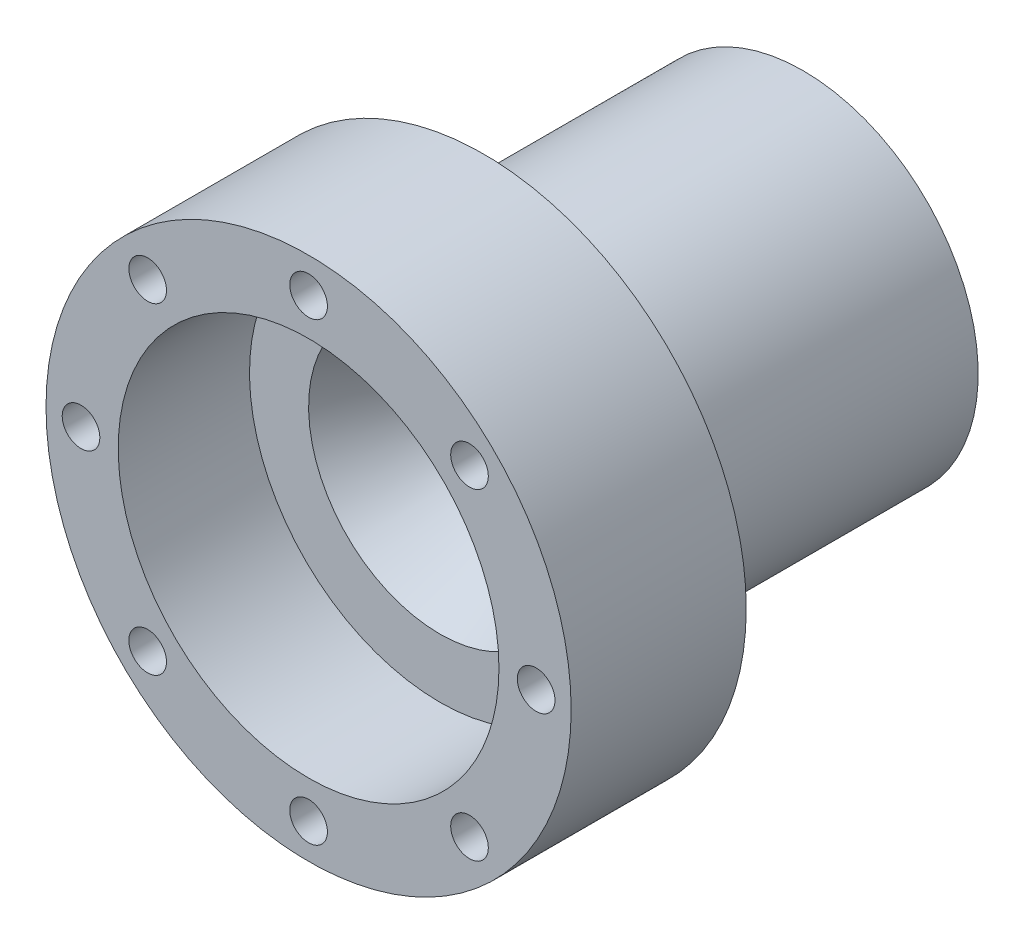
from build123d import *

# Parameters (mm, degrees)
BOSS_EXTRUDE1_START  = -5
SKETCH4_R            = 30
SKETCH4_R_2          = 20
BOSS_EXTRUDE1_DEPTH  = 5
SKETCH5_R            = 30
SKETCH5_R_2          = 21.75
BOSS_EXTRUDE2_DEPTH  = 15
M4_CLEARANCE_HOLE1_D = 4.3
CIRPATTERN1_COUNT    = 8


with BuildPart() as part:
    # Sketch2 → Revolve1 (revolve)
    with BuildSketch(Plane(origin=(0, 0, 0), x_dir=(0, 0, -1), z_dir=(1, 0, 0))):
        Polygon((21.328670365, 20), (21.328670365, 10.285), (0, 4.57), (-2.106039712, 4.57), (-20.171329635, 15), (-20.171329635, 20), align=None)
    revolve(axis=Axis((0, 0, 0), (0, 0, 1)))

    # Sketch4 → Boss-Extrude1 (add)
    with BuildSketch(Plane.XY.offset(20.171329635).offset(BOSS_EXTRUDE1_START)):
        Circle(SKETCH4_R)
        with Locations(Location((0, 0, 0), (0, 0, 90))):
            Circle(SKETCH4_R_2, mode=Mode.SUBTRACT)
    extrude(amount=BOSS_EXTRUDE1_DEPTH)

    # Sketch5 → Boss-Extrude2 (add)
    with BuildSketch(Plane.XY.offset(20.171329635)):
        Circle(SKETCH5_R)
        with Locations(Location((0, 0, 0), (0, 0, 270))):
            Circle(SKETCH5_R_2, mode=Mode.SUBTRACT)
    extrude(amount=BOSS_EXTRUDE2_DEPTH)

    # M4 Clearance Hole1 (through all)
    with Locations(Plane(origin=(0, 0, 15.171329635), x_dir=(-1, 0, 0), z_dir=(0, 0, -1))):
        with Locations((0, 26)):
            m4_clearance_hole1 = Hole(M4_CLEARANCE_HOLE1_D / 2)

    # CirPattern1: M4 Clearance Hole1 ×8 about axis
    cirpattern1_axis = Axis((0, 0, 0), (0, 0, 1))
    for i in range(1, CIRPATTERN1_COUNT):
        add(m4_clearance_hole1.rotate(cirpattern1_axis, i * 360 / CIRPATTERN1_COUNT), mode=Mode.SUBTRACT)


solid = part.part
